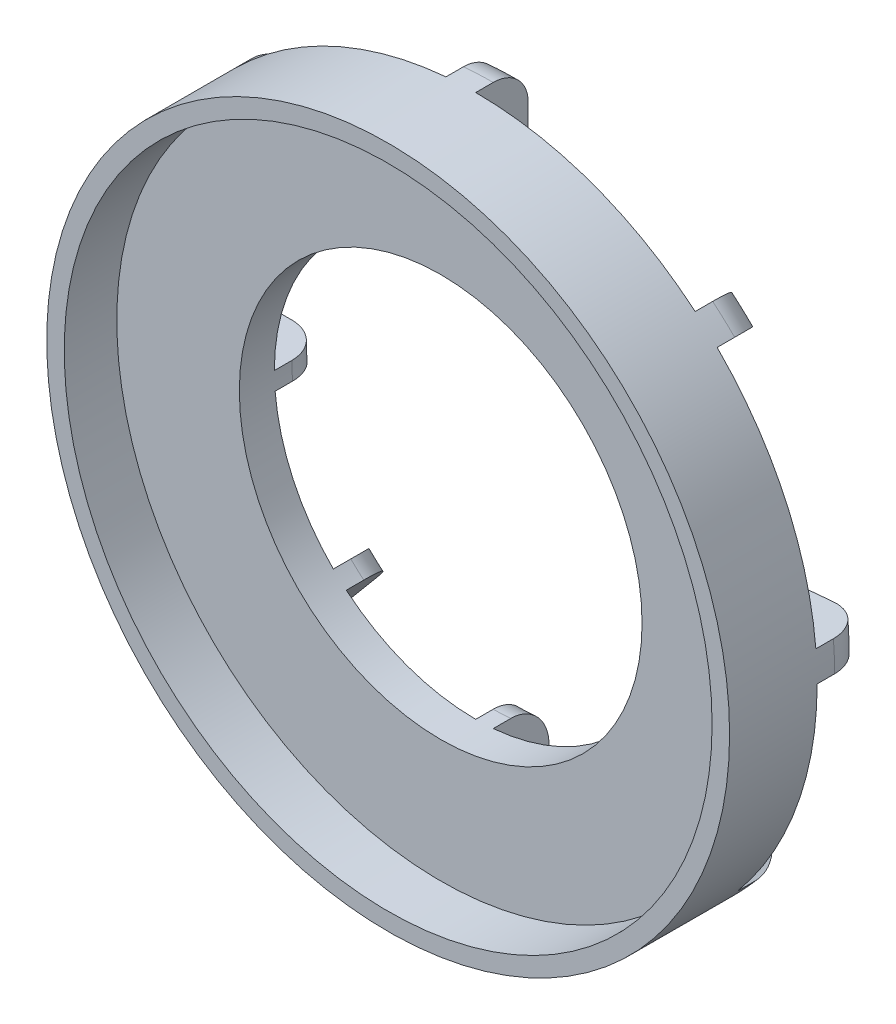
from build123d import *
from build123d.topology import SkipClean

# Parameters (mm, degrees)
SKETCH1_R                = 18.5
SKETCH1_R_2              = 11.5
BOSS_EXTRUDE1_DEPTH      = 2
SKETCH1_4_R              = 19.5
SKETCH1_4_R_2            = 18.5
BOSS_EXTRUDE2_DEPTH      = 5
BOSS_EXTRUDE3_START      = 3
BOSS_EXTRUDE3_DEPTH      = 3
FILLET2_R                = 2
CIRPATTERN1_COUNT        = 8
FILLET2_OF_CIRPATTERN1_R = 2


with BuildPart() as part:
    # Sketch1 → Boss-Extrude1 (new body)
    with BuildSketch(Plane.XY):
        Circle(SKETCH1_R)
        Circle(SKETCH1_R_2, mode=Mode.SUBTRACT)
    extrude(amount=BOSS_EXTRUDE1_DEPTH)

    # Sketch1<4> → Boss-Extrude2 (add)
    with BuildSketch(Plane.XY):
        Circle(SKETCH1_4_R)
        Circle(SKETCH1_4_R_2, mode=Mode.SUBTRACT)
    extrude(amount=BOSS_EXTRUDE2_DEPTH)

    # Sketch2 → Boss-Extrude3 (add)
    with SkipClean():  # the faces are left unmerged after this step: merging them gives an invalid solid
        with BuildSketch(Plane(origin=(0, 0, 0), x_dir=(-1, 0, 0), z_dir=(0, 0, -1)).offset(BOSS_EXTRUDE3_START)):
            with BuildLine():
                ThreePointArc((1.699536984, 19.425796613), (0.850578054, 19.481440321), (0, 19.5))
                Line((0, 19.5), (0, 11.5))
                ThreePointArc((0, 11.5), (0.501622955, 11.489054548), (1.002291042, 11.456239028))
                Line((1.002291042, 11.456239028), (1.699536984, 19.425796613))
            make_face()
        boss_extrude3 = extrude(amount=-BOSS_EXTRUDE3_DEPTH)

    # Fillet2
    fillet2_edges = [part.edges().sort_by_distance(p)[0] for p in [
        (-0.850578054, 19.481440321, -3),
        (-0.501622955, 11.489054548, -3),
    ]]
    fillet(fillet2_edges, radius=FILLET2_R)

    # CirPattern1: Boss-Extrude3 ×8 about axis
    with SkipClean():  # the faces are left unmerged after this step: merging them gives an invalid solid
        cirpattern1_axis = Axis((0, 0, 5.4), (0, 0, -1))
        for i in range(1, CIRPATTERN1_COUNT):
            add(boss_extrude3.rotate(cirpattern1_axis, i * 360 / CIRPATTERN1_COUNT))

    # Fillet2 of CirPattern1
    fillet2_of_cirpattern1_edges = [part.edges().sort_by_distance(p)[0] for p in [
        (13.174009049, 14.376908068, -3),
        (7.769287388, 8.478689373, -3),
        (19.481440321, 0.850578054, -3),
        (11.489054548, 0.501622955, -3),
        (14.376908068, -13.174009049, -3),
        (8.478689373, -7.769287388, -3),
        (0.850578054, -19.481440321, -3),
        (0.501622955, -11.489054548, -3),
        (-13.174009049, -14.376908068, -3),
        (-7.769287388, -8.478689373, -3),
        (-19.481440321, -0.850578054, -3),
        (-11.489054548, -0.501622955, -3),
        (-14.376908068, 13.174009049, -3),
        (-8.478689373, 7.769287388, -3),
    ]]
    fillet(fillet2_of_cirpattern1_edges, radius=FILLET2_OF_CIRPATTERN1_R)


solid = part.part
